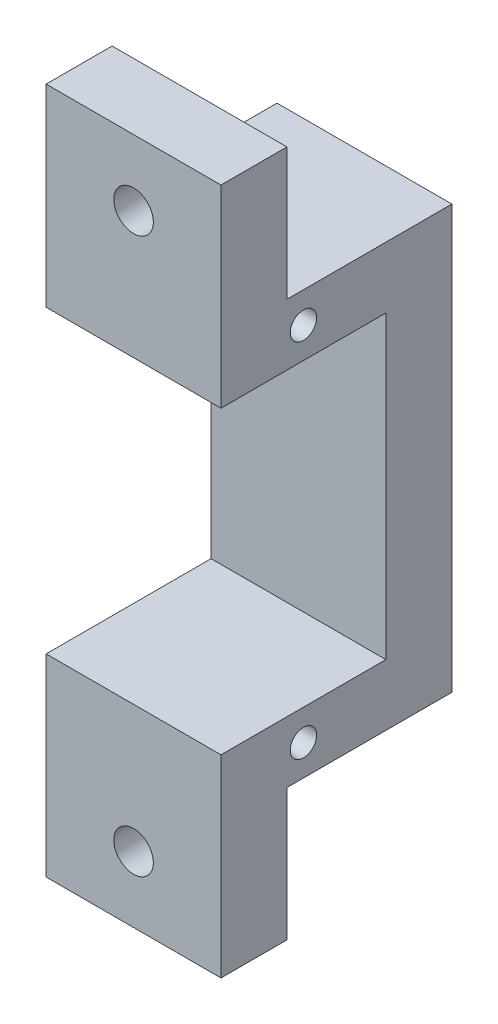
from build123d import *

# Parameters (mm, degrees)
ESBO_O1_W                = 13.25
ESBO_O1_H                = 12.5
RESSALTO_EXTRUS_O1_DEPTH = 4.65
ESBO_O2_W                = 13.25
ESBO_O2_H                = 32.05
RESSALTO_EXTRUS_O2_DEPTH = 5
ESBO_O3_W                = 13.25
ESBO_O3_H                = 4.65
RESSALTO_EXTRUS_O3_DEPTH = 12.5
ESBO_O4_W                = 13.25
ESBO_O4_H                = 5
RESSALTO_EXTRUS_O4_DEPTH = 10
ESBO_O5_W                = 13.25
ESBO_O5_H                = 5
RESSALTO_EXTRUS_O5_DEPTH = 10
ESBO_O6_R                = 1.5
CORTE_EXTRUS_O1_DEPTH    = 10
ESBO_O7_R                = 1
CORTE_EXTRUS_O2_DEPTH    = 48.87512604
ESBO_O8_R                = 1
CORTE_EXTRUS_O3_DEPTH    = 48.87512604


with BuildPart() as part:
    # Esboço1 → Ressalto-extrusão1 (new body)
    with BuildSketch(Plane(origin=(0, 0, 0), x_dir=(1, 0, 0), z_dir=(0, 1, 0))):
        with Locations((-15.112918198, -12.411797698)):
            Rectangle(ESBO_O1_W, ESBO_O1_H)
    extrude(amount=-RESSALTO_EXTRUS_O1_DEPTH)

    # Esboço2 → Ressalto-extrusão2 (add)
    with BuildSketch(Plane(origin=(0, 0, 6.161797698), x_dir=(-1, 0, 0), z_dir=(0, 0, -1))):
        with Locations((15.112918198, -16.025)):
            Rectangle(ESBO_O2_W, ESBO_O2_H)
    extrude(amount=RESSALTO_EXTRUS_O2_DEPTH)

    # Esboço3 → Ressalto-extrusão3 (add)
    with BuildSketch(Plane.XY.offset(6.161797698)):
        with Locations((-15.112918198, -29.725)):
            Rectangle(ESBO_O3_W, ESBO_O3_H)
    extrude(amount=RESSALTO_EXTRUS_O3_DEPTH)

    # Esboço4 → Ressalto-extrusão4 (add)
    with BuildSketch(Plane(origin=(0, -32.05, 0), x_dir=(-1, 0, 0), z_dir=(0, -1, 0))):
        with Locations((15.112918198, -16.161797698)):
            Rectangle(ESBO_O4_W, ESBO_O4_H)
    extrude(amount=RESSALTO_EXTRUS_O4_DEPTH)

    # Esboço5 → Ressalto-extrusão5 (add)
    with BuildSketch(Plane(origin=(0, 0, 0), x_dir=(1, 0, 0), z_dir=(0, 1, 0))):
        with Locations((-15.112918198, -16.161797698)):
            Rectangle(ESBO_O5_W, ESBO_O5_H)
    extrude(amount=RESSALTO_EXTRUS_O5_DEPTH)

    # Esboço6 → Corte-extrusão1 (cut)
    with BuildSketch(Plane(origin=(0, 0, 13.661797698), x_dir=(-1, 0, 0), z_dir=(0, 0, -1))):
        with Locations((15.112918198, 5)):
            Circle(ESBO_O6_R)
        with Locations((15.112918198, -37.05)):
            Circle(ESBO_O6_R)
    extrude(amount=-CORTE_EXTRUS_O1_DEPTH, mode=Mode.SUBTRACT)

    # Esboço7 → Corte-extrusão2 (cut, through all)
    with BuildSketch(Plane(origin=(-8.487918198, 0, 0), x_dir=(0, 0, -1), z_dir=(1, 0, 0))):
        with Locations((-12.411797698, -2.325)):
            Circle(ESBO_O7_R)
    extrude(amount=-CORTE_EXTRUS_O2_DEPTH, mode=Mode.SUBTRACT)

    # Esboço8 → Corte-extrusão3 (cut, through all)
    with BuildSketch(Plane(origin=(-8.487918198, 0, 0), x_dir=(0, 0, -1), z_dir=(1, 0, 0))):
        with Locations((-12.411797698, -29.725)):
            Circle(ESBO_O8_R)
    extrude(amount=-CORTE_EXTRUS_O3_DEPTH, mode=Mode.SUBTRACT)


solid = part.part
